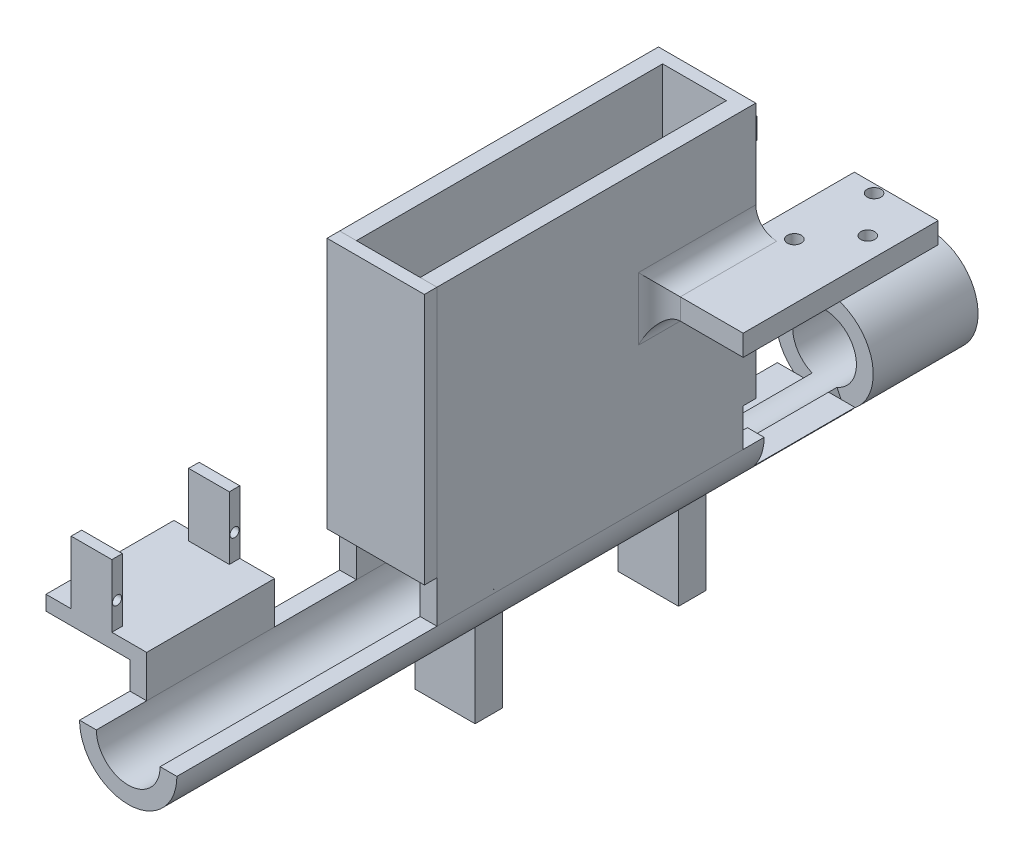
from build123d import *
from build123d.topology import SkipClean

# Parameters (mm, degrees)
BOSS_EXTRUDE1_DEPTH    = 140
SKETCH2_W              = 4
SKETCH2_H              = 73
BOSS_EXTRUDE2_DEPTH    = 70
BOSS_EXTRUDE2_2_DEPTH  = 70
SKETCH5_W              = 23.2
SKETCH5_H              = 61
BOSS_EXTRUDE3_DEPTH    = 3
SKETCH6_W              = 23.2
SKETCH6_H              = 60
BOSS_EXTRUDE4_DEPTH    = 3
SKETCH7_W              = 4
SKETCH7_H              = 30.5
BOSS_EXTRUDE5_DEPTH    = 10
SKETCH8_W              = 30.5
SKETCH8_H              = 3.5
BOSS_EXTRUDE6_DEPTH    = 20
SKETCH10_W             = 9.7
SKETCH10_H             = 2.5
BOSS_EXTRUDE7_DEPTH    = 15
SKETCH11_R             = 1.1
CUT_EXTRUDE1_DEPTH     = 7
BOSS_EXTRUDE8_START    = 24
BOSS_EXTRUDE8_DEPTH    = 24
SKETCH28_W             = 20
SKETCH28_H             = 5
BOSS_EXTRUDE17_DEPTH   = 20
SKETCH29_W             = 20
SKETCH29_H             = 5
BOSS_EXTRUDE18_DEPTH   = 26.5
FILLET1_R              = 5
SKETCH33_W             = 20
SKETCH33_H             = 5
BOSS_EXTRUDE19_DEPTH   = 20
SKETCH34_W             = 20
SKETCH34_H             = 5
BOSS_EXTRUDE20_DEPTH   = 26.5
FILLET3_R              = 5
SKETCH32_W             = 20
SKETCH32_H             = 55
CUT_EXTRUDE4_DEPTH     = 2.5
SKETCH35_W             = 14.38749457
SKETCH35_H             = 6.5
BOSS_EXTRUDE21_DEPTH   = 20
BOSS_EXTRUDE21_2_DEPTH = 20
SKETCH38_R             = 2.65
CUT_EXTRUDE6_DEPTH     = 10
SKETCH39_R             = 2.65
CUT_EXTRUDE7_DEPTH     = 10
SKETCH43_R             = 1.65
CUT_EXTRUDE8_DEPTH     = 5
BOSS_EXTRUDE22_START   = 2
BOSS_EXTRUDE22_DEPTH   = 2
BOSS_EXTRUDE23_START   = 25
SKETCH44_R             = 11.6
SKETCH44_R_2           = 7.6
BOSS_EXTRUDE23_DEPTH   = 25


with BuildPart() as part:
    # Sketch1 → Boss-Extrude1 (new body)
    with BuildSketch(Plane.XY):
        with BuildLine():
            Line((-11.6, 0), (-7.6, 0))
            ThreePointArc((-7.6, 0), (0, -7.6), (7.6, 0))
            Line((7.6, 0), (11.6, 0))
            ThreePointArc((11.6, 0), (0, -11.6), (-11.6, 0))
        make_face()
    extrude(amount=BOSS_EXTRUDE1_DEPTH)

    # Sketch7 → Boss-Extrude5 (add)
    with BuildSketch(Plane(origin=(0, 0, 0), x_dir=(1, 0, 0), z_dir=(0, 1, 0))):
        with Locations((-9.6, -112.75)):
            Rectangle(SKETCH7_W, SKETCH7_H)
    extrude(amount=BOSS_EXTRUDE5_DEPTH)

    # Sketch8 → Boss-Extrude6 (add)
    with BuildSketch(Plane.ZY.offset(11.6)):
        with Locations((112.75, 8.25)):
            Rectangle(SKETCH8_W, SKETCH8_H)
    extrude(amount=BOSS_EXTRUDE6_DEPTH)

    # Sketch10 → Boss-Extrude7 (add)
    with BuildSketch(Plane(origin=(0, 10, 0), x_dir=(1, 0, 0), z_dir=(0, 1, 0))):
        with Locations((-20.75, -126.75)):
            Rectangle(SKETCH10_W, SKETCH10_H)
        with Locations((-20.75, -98.75)):
            Rectangle(SKETCH10_W, SKETCH10_H)
    extrude(amount=BOSS_EXTRUDE7_DEPTH)

    # Sketch11 → Cut-Extrude1 (cut)
    with BuildSketch(Plane(origin=(-15.9, 0, 0), x_dir=(0, 0, -1), z_dir=(1, 0, 0))):
        with Locations((-98.75, 16)):
            Circle(SKETCH11_R)
        with Locations((-126.75, 16)):
            Circle(SKETCH11_R)
    extrude(amount=-CUT_EXTRUDE1_DEPTH, mode=Mode.SUBTRACT)

    # Sketch12 → Boss-Extrude8 (add)
    with BuildSketch(Plane(origin=(0, 0, 0), x_dir=(-1, 0, 0), z_dir=(0, 0, -1)).offset(BOSS_EXTRUDE8_START)):
        with BuildLine():
            Line((-9.249864864, -7), (-2.959729717, -7))
            ThreePointArc((-2.959729717, -7), (0, -7.6), (2.959729717, -7))
            Line((2.959729717, -7), (9.249864864, -7))
            ThreePointArc((9.249864864, -7), (0, -11.6), (-9.249864864, -7))
        make_face()
    extrude(amount=-BOSS_EXTRUDE8_DEPTH)

    # Sketch32 → Cut-Extrude4 (cut)
    with BuildSketch(Plane(origin=(0, -11.6, 0), x_dir=(-1, 0, 0), z_dir=(0, -1, 0))):
        with Locations((0, -37)):
            Rectangle(SKETCH32_W, SKETCH32_H)
    extrude(amount=-CUT_EXTRUDE4_DEPTH, mode=Mode.SUBTRACT)

    # Sketch41 → Boss-Extrude22 (add)
    with BuildSketch(Plane(origin=(0, 0, -24), x_dir=(-1, 0, 0), z_dir=(0, 0, -1)).offset(BOSS_EXTRUDE22_START)):
        with BuildLine():
            Line((-4.711687596, -10.6), (-2.959729717, -7))
            ThreePointArc((-2.959729717, -7), (0, -7.6), (2.959729717, -7))
            Line((2.959729717, -7), (4.711687596, -10.6))
            ThreePointArc((4.711687596, -10.6), (0, -11.6), (-4.711687596, -10.6))
        make_face()
    extrude(amount=-BOSS_EXTRUDE22_DEPTH)

    # Sketch44 → Boss-Extrude23 (add)
    with SkipClean():  # the faces are left unmerged after this step: merging them gives an invalid solid
        with BuildSketch(Plane(origin=(0, 0, -26), x_dir=(-1, 0, 0), z_dir=(0, 0, -1)).offset(BOSS_EXTRUDE23_START)):
            Circle(SKETCH44_R)
            Circle(SKETCH44_R_2, mode=Mode.SUBTRACT)
        extrude(amount=-BOSS_EXTRUDE23_DEPTH)


with BuildPart() as body_2:
    # Sketch2 → Boss-Extrude2 (new body)
    with BuildSketch(Plane(origin=(0, 0, 0), x_dir=(1, 0, 0), z_dir=(0, 1, 0))):
        with Locations((-9.6, -41.5)):
            Rectangle(SKETCH2_W, SKETCH2_H)
    extrude(amount=BOSS_EXTRUDE2_DEPTH)



with BuildPart() as body_3:
    # Sketch2 → Boss-Extrude2 2 (new body)
    with BuildSketch(Plane(origin=(0, 0, 0), x_dir=(1, 0, 0), z_dir=(0, 1, 0))):
        with Locations((9.6, -41.5)):
            Rectangle(SKETCH2_W, SKETCH2_H)
    extrude(amount=BOSS_EXTRUDE2_2_DEPTH)



with BuildPart() as body_4:
    # Sketch5 → Boss-Extrude3 (new body)
    with BuildSketch(Plane(origin=(0, 0, 5), x_dir=(-1, 0, 0), z_dir=(0, 0, -1))):
        with Locations((0, 39.5)):
            Rectangle(SKETCH5_W, SKETCH5_H)
    extrude(amount=BOSS_EXTRUDE3_DEPTH)


with BuildPart() as body_5:
    # Sketch6 → Boss-Extrude4 (new body)
    with BuildSketch(Plane.XY.offset(78)):
        with Locations((0, 40)):
            Rectangle(SKETCH6_W, SKETCH6_H)
    extrude(amount=BOSS_EXTRUDE4_DEPTH)


with BuildPart() as body_3_1:
    add(body_3.part)

    add(body_4.part)  # Boss-Extrude17 merges body 4
    # Sketch28 → Boss-Extrude17 (add)
    with BuildSketch(Plane(origin=(11.6, 0, 0), x_dir=(0, 0, -1), z_dir=(1, 0, 0))):
        with Locations((-15, 41.5)):
            Rectangle(SKETCH28_W, SKETCH28_H)
    extrude(amount=BOSS_EXTRUDE17_DEPTH)

    # Sketch29 → Boss-Extrude18 (add)
    with BuildSketch(Plane(origin=(0, 0, 5), x_dir=(-1, 0, 0), z_dir=(0, 0, -1))):
        with Locations((-21.6, 41.5)):
            Rectangle(SKETCH29_W, SKETCH29_H)
    extrude(amount=BOSS_EXTRUDE18_DEPTH)

    # Fillet1
    fillet1_edges = [body_3_1.edges().sort_by_distance(p)[0] for p in [
        (11.6, 44, 13.5),
        (11.6, 41.5, 25),
        (11.6, 39, 13.5),
    ]]
    fillet(fillet1_edges, radius=FILLET1_R)


with BuildPart() as body_2_1:
    add(body_2.part)

    add(body_3_1.part)  # Boss-Extrude19 merges body 3
    # Sketch33 → Boss-Extrude19 (add)
    with BuildSketch(Plane.ZY.offset(11.6)):
        with Locations((15, 41.5)):
            Rectangle(SKETCH33_W, SKETCH33_H)
    extrude(amount=BOSS_EXTRUDE19_DEPTH)

    # Sketch34 → Boss-Extrude20 (add)
    with BuildSketch(Plane(origin=(0, 0, 5), x_dir=(-1, 0, 0), z_dir=(0, 0, -1))):
        with Locations((21.6, 41.5)):
            Rectangle(SKETCH34_W, SKETCH34_H)
    extrude(amount=BOSS_EXTRUDE20_DEPTH)

    # Fillet3
    fillet3_edges = [body_2_1.edges().sort_by_distance(p)[0] for p in [
        (-11.6, 39, 13.5),
        (-11.6, 41.5, 25),
        (-11.6, 44, 13.5),
    ]]
    fillet(fillet3_edges, radius=FILLET3_R)

    # Sketch43 → Cut-Extrude8 (cut)
    with BuildSketch(Plane(origin=(0, 44, 0), x_dir=(1, 0, 0), z_dir=(0, 1, 0))):
        with Locations(Location((18.3, 19.5, 0), (0, 0, 270))):
            Circle(SKETCH43_R)
        with Locations(Location((18.3, 0.5, 0), (0, 0, 270))):
            Circle(SKETCH43_R)
        with Locations(Location((26.3, 10, 0), (0, 0, 270))):
            Circle(SKETCH43_R)
    cut_extrude8 = extrude(amount=-CUT_EXTRUDE8_DEPTH, mode=Mode.SUBTRACT)

    # Mirror1: Cut-Extrude8 across plane
    add(cut_extrude8.mirror(Plane(origin=(0, 0, 0), x_dir=(0, 0, 1), z_dir=(1, 0, 0))), mode=Mode.SUBTRACT)


with BuildPart() as body_4_2:
    # Sketch35 → Boss-Extrude21 (new body)
    with BuildSketch(Plane.XZ.offset(9.1)):
        with Locations((0, 61.25)):
            Rectangle(SKETCH35_W, SKETCH35_H)
    extrude(amount=BOSS_EXTRUDE21_DEPTH)

    # Sketch39 → Cut-Extrude7 (cut)
    with BuildSketch(Plane.ZY.offset(7.193747285)):
        with Locations((61.25, -14.6)):
            Circle(SKETCH39_R)
        with Locations((61.25, -23.6)):
            Circle(SKETCH39_R)
    extrude(amount=-CUT_EXTRUDE7_DEPTH, mode=Mode.SUBTRACT)


with BuildPart() as body_5_2:
    # Sketch35 → Boss-Extrude21 2 (new body)
    with BuildSketch(Plane.XZ.offset(9.1)):
        with Locations((0, 12.75)):
            Rectangle(SKETCH35_W, SKETCH35_H)
    extrude(amount=BOSS_EXTRUDE21_2_DEPTH)

    # Sketch38 → Cut-Extrude6 (cut)
    with BuildSketch(Plane.ZY.offset(7.193747285)):
        with Locations((12.75, -14.6)):
            Circle(SKETCH38_R)
        with Locations((12.75, -23.6)):
            Circle(SKETCH38_R)
    extrude(amount=-CUT_EXTRUDE6_DEPTH, mode=Mode.SUBTRACT)


solid = Compound([part.part, body_5.part, body_2_1.part, body_4_2.part, body_5_2.part])
